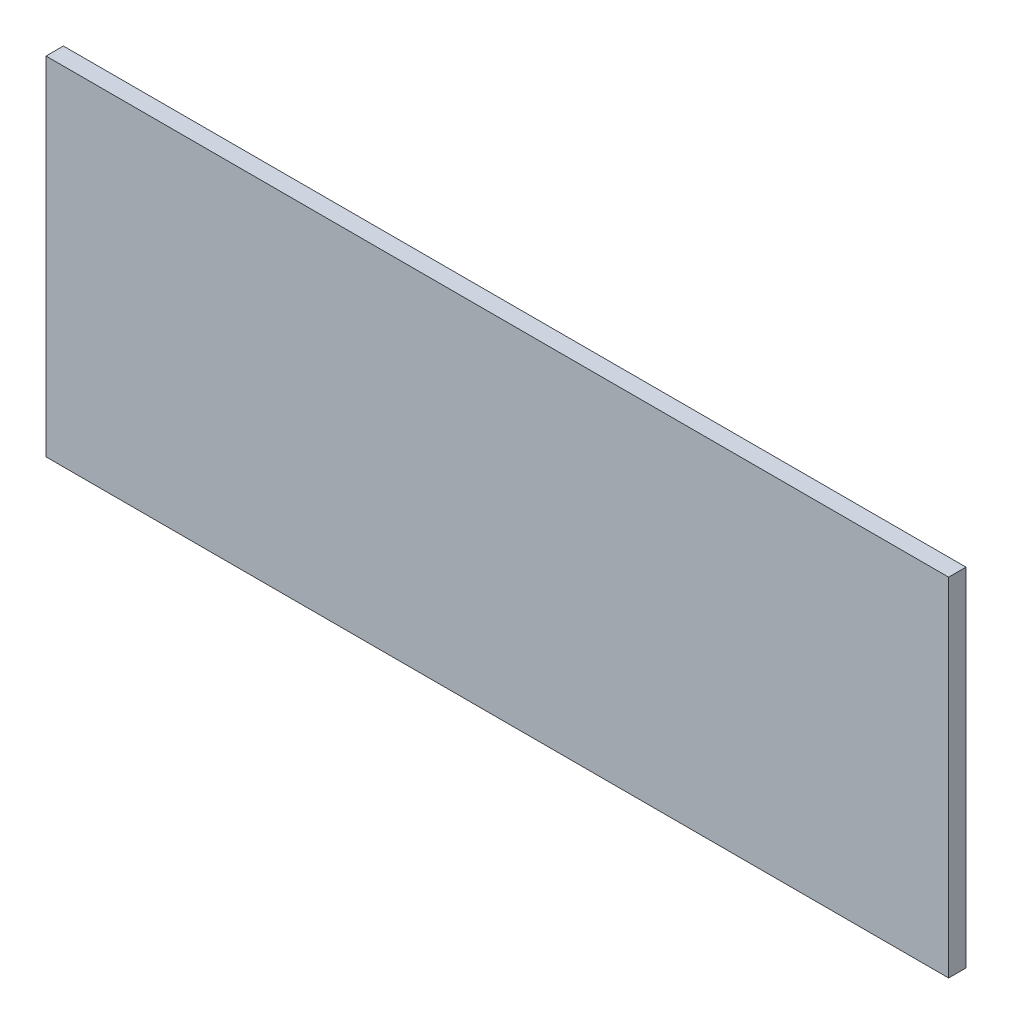
from build123d import *

# Parameters (mm, degrees)
ESQUISSE1_W        = 156
ESQUISSE1_H        = 60
BOSS_EXTRU_1_DEPTH = 3


with BuildPart() as part:
    # Esquisse1 → Boss.-Extru.1 (new body)
    with BuildSketch(Plane.XY):
        with Locations((1.5, 22.484499856)):
            Rectangle(ESQUISSE1_W, ESQUISSE1_H)
    extrude(amount=BOSS_EXTRU_1_DEPTH)


solid = part.part
